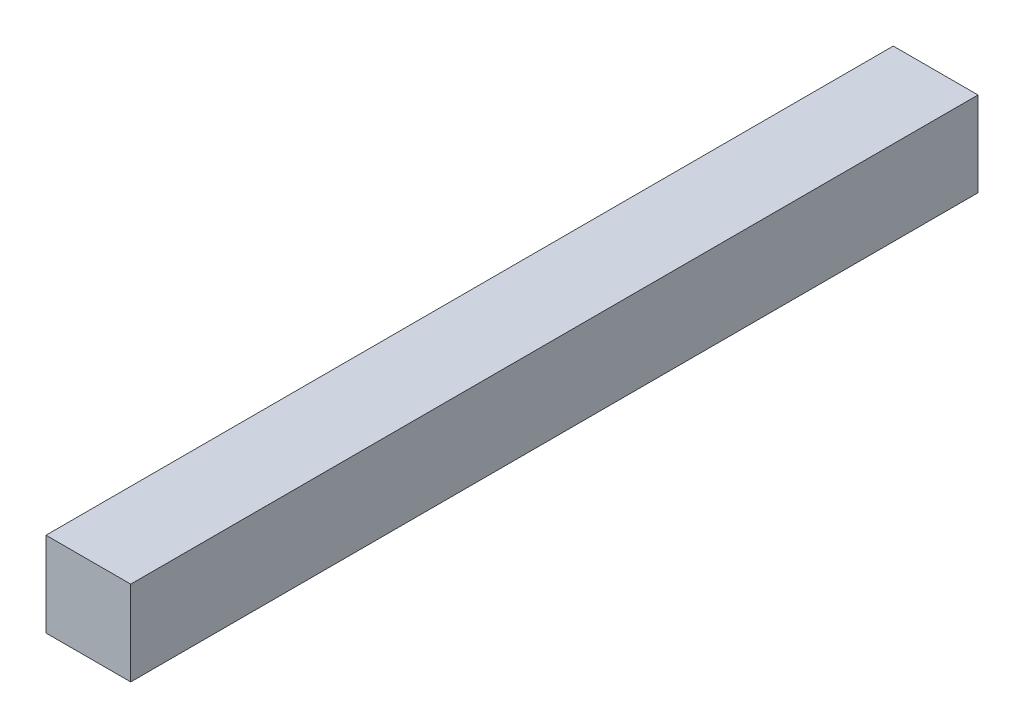
from build123d import *

# Parameters (mm, degrees)
SKETCH2_W           = 10
SKETCH2_H           = 10
BOSS_EXTRUDE1_DEPTH = 100


with BuildPart() as part:
    # Sketch2 → Boss-Extrude1 (new body)
    with BuildSketch(Plane.XY):
        Rectangle(SKETCH2_W, SKETCH2_H)
    extrude(amount=-BOSS_EXTRUDE1_DEPTH)


solid = part.part
